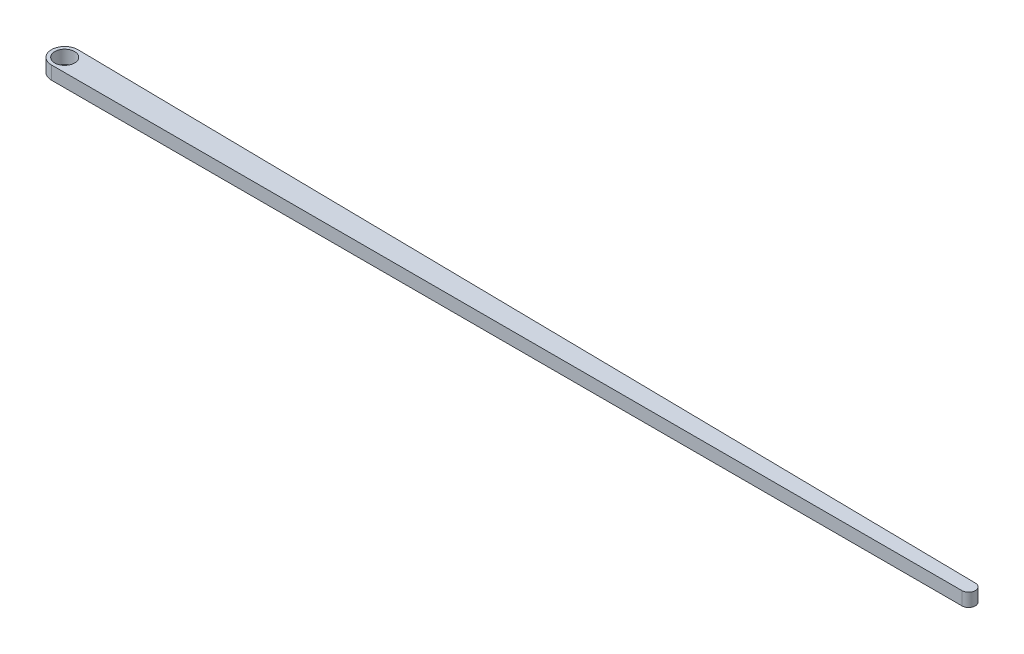
from build123d import *

# Parameters (mm, degrees)
BOSS_EXTRUDE1_DEPTH = 32


with BuildPart() as part:
    # Sketch1 → Boss-Extrude1 (new body)
    with BuildSketch(Plane(origin=(0, 0, 0), x_dir=(1, 0, 0), z_dir=(0, 1, 0))):
        with BuildLine():
            ThreePointArc((0, 64), (-32, 32), (0, 0))
            Line((0, 0), (0, 8))
            ThreePointArc((0, 8), (-24, 32), (0, 56))
            Line((0, 56), (0, 64))
        make_face()
        with BuildLine():
            Line((0, 8), (0, 0))
            ThreePointArc((0, 0), (22.627416998, 9.372583002), (32, 32))
            ThreePointArc((32, 32), (22.954114988, 54.295932479), (0.93071218, 63.986462368))
            Line((0.93071218, 63.986462368), (0, 64))
            Line((0, 64), (0, 56))
            ThreePointArc((0, 56), (16.970562748, 48.970562748), (24, 32))
            ThreePointArc((24, 32), (16.970562748, 15.029437252), (0, 8))
        make_face()
        with BuildLine():
            ThreePointArc((32, 32), (22.627416998, 9.372583002), (0, 0))
            Line((0, 0), (2200, 0))
            ThreePointArc((2200, 0), (2184, 16), (2200, 32))
            Line((2200, 32), (0.93071218, 63.986462368))
            ThreePointArc((0.93071218, 63.986462368), (22.954114988, 54.295932479), (32, 32))
        make_face()
        with BuildLine():
            ThreePointArc((2200, 32), (2184, 16), (2200, 0))
            Line((2200, 0), (2200, 32))
        make_face()
        with BuildLine():
            Line((2200, 32), (2200, 0))
            ThreePointArc((2200, 0), (2211.313708499, 4.686291501), (2216, 16))
            ThreePointArc((2216, 16), (2211.313708499, 27.313708499), (2200, 32))
        make_face()
    extrude(amount=BOSS_EXTRUDE1_DEPTH)


solid = part.part
